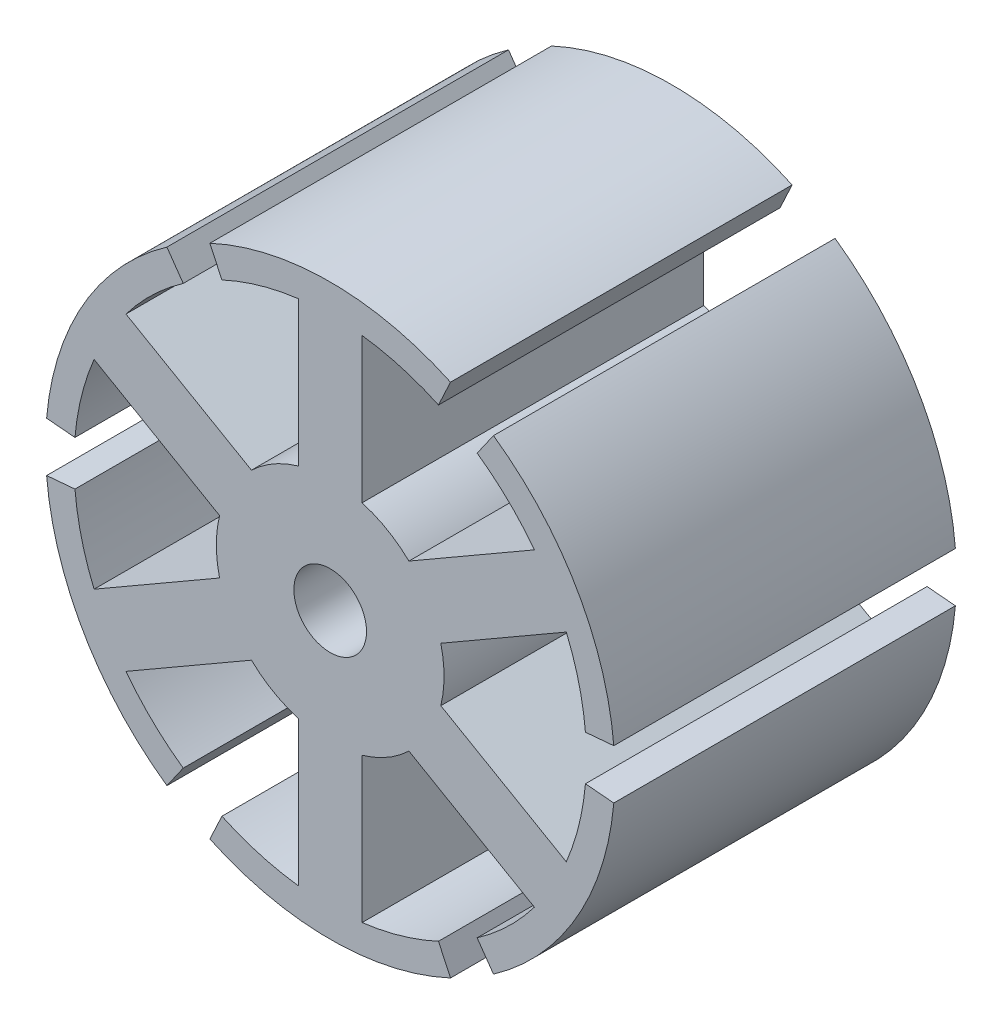
from build123d import *

# Parameters (mm, degrees)
SKETCH2_R           = 25
BOSS_EXTRUDE2_DEPTH = 30
CUT_EXTRUDE2_START  = -30
CUT_EXTRUDE2_DEPTH  = 30
SKETCH4_R           = 3.19
CUT_EXTRUDE3_DEPTH  = 30


with BuildPart() as part:
    # Sketch2 → Boss-Extrude2 (new body)
    with BuildSketch(Plane.XY):
        Circle(SKETCH2_R)
    extrude(amount=BOSS_EXTRUDE2_DEPTH)

    # Sketch3 → Cut-Extrude2 (cut)
    with BuildSketch(Plane.XY.offset(30).offset(CUT_EXTRUDE2_START)):
        with BuildLine():
            Line((6.913843876, -7.224871131), (17.934101996, -13.587420123))
            ThreePointArc((17.934101996, -13.587420123), (15.608801126, -16.205410436), (12.905469818, -18.430920997))
            Line((12.905469818, -18.430920997), (14.339410909, -20.478801107))
            ThreePointArc((14.339410909, -20.478801107), (12.5, -21.650635095), (10.565456544, -22.657694676))
            Line((10.565456544, -22.657694676), (9.508910889, -20.391925208))
            ThreePointArc((9.508910889, -20.391925208), (6.229896553, -21.620323516), (2.8, -22.325097984))
            Line((2.8, -22.325097984), (2.8, -9.6))
            ThreePointArc((2.8, -9.6), (5, -8.660254038), (6.913843876, -7.224871131))
        make_face()
        with BuildLine():
            Line((9.713843876, -2.375128869), (20.734101996, -8.737677861))
            ThreePointArc((20.734101996, -8.737677861), (21.83869768, -5.41491308), (22.414380707, -1.961004212))
            Line((22.414380707, -1.961004212), (24.904867452, -2.178893569))
            ThreePointArc((24.904867452, -2.178893569), (25, 0), (24.904867452, 2.178893569))
            Line((24.904867452, 2.178893569), (22.414380707, 1.961004212))
            ThreePointArc((22.414380707, 1.961004212), (21.83869768, 5.41491308), (20.734101996, 8.737677861))
            Line((20.734101996, 8.737677861), (9.713843876, 2.375128869))
            ThreePointArc((9.713843876, 2.375128869), (10, 0), (9.713843876, -2.375128869))
        make_face()
        with BuildLine():
            Line((-2.8, -9.6), (-2.8, -22.325097984))
            ThreePointArc((-2.8, -22.325097984), (-6.229896553, -21.620323516), (-9.508910889, -20.391925208))
            Line((-9.508910889, -20.391925208), (-10.565456544, -22.657694676))
            ThreePointArc((-10.565456544, -22.657694676), (-12.5, -21.650635095), (-14.339410909, -20.478801107))
            Line((-14.339410909, -20.478801107), (-12.905469818, -18.430920997))
            ThreePointArc((-12.905469818, -18.430920997), (-15.608801126, -16.205410436), (-17.934101996, -13.587420123))
            Line((-17.934101996, -13.587420123), (-6.913843876, -7.224871131))
            ThreePointArc((-6.913843876, -7.224871131), (-5, -8.660254038), (-2.8, -9.6))
        make_face()
        with BuildLine():
            Line((-9.713843876, -2.375128869), (-20.734101996, -8.737677861))
            ThreePointArc((-20.734101996, -8.737677861), (-21.83869768, -5.41491308), (-22.414380707, -1.961004212))
            Line((-22.414380707, -1.961004212), (-24.904867452, -2.178893569))
            ThreePointArc((-24.904867452, -2.178893569), (-25, 0), (-24.904867452, 2.178893569))
            Line((-24.904867452, 2.178893569), (-22.414380707, 1.961004212))
            ThreePointArc((-22.414380707, 1.961004212), (-21.83869768, 5.41491308), (-20.734101996, 8.737677861))
            Line((-20.734101996, 8.737677861), (-9.713843876, 2.375128869))
            ThreePointArc((-9.713843876, 2.375128869), (-10, 0), (-9.713843876, -2.375128869))
        make_face()
        with BuildLine():
            Line((-6.913843876, 7.224871131), (-17.934101996, 13.587420123))
            ThreePointArc((-17.934101996, 13.587420123), (-15.608801126, 16.205410436), (-12.905469818, 18.430920997))
            Line((-12.905469818, 18.430920997), (-14.339410909, 20.478801107))
            ThreePointArc((-14.339410909, 20.478801107), (-12.5, 21.650635095), (-10.565456544, 22.657694676))
            Line((-10.565456544, 22.657694676), (-9.508910889, 20.391925208))
            ThreePointArc((-9.508910889, 20.391925208), (-6.229896553, 21.620323516), (-2.8, 22.325097984))
            Line((-2.8, 22.325097984), (-2.8, 9.6))
            ThreePointArc((-2.8, 9.6), (-5, 8.660254038), (-6.913843876, 7.224871131))
        make_face()
        with BuildLine():
            Line((2.8, 9.6), (2.8, 22.325097984))
            ThreePointArc((2.8, 22.325097984), (6.229896553, 21.620323516), (9.508910889, 20.391925208))
            Line((9.508910889, 20.391925208), (10.565456544, 22.657694676))
            ThreePointArc((10.565456544, 22.657694676), (12.5, 21.650635095), (14.339410909, 20.478801107))
            Line((14.339410909, 20.478801107), (12.905469818, 18.430920997))
            ThreePointArc((12.905469818, 18.430920997), (15.608801126, 16.205410436), (17.934101996, 13.587420123))
            Line((17.934101996, 13.587420123), (6.913843876, 7.224871131))
            ThreePointArc((6.913843876, 7.224871131), (5, 8.660254038), (2.8, 9.6))
        make_face()
    extrude(amount=CUT_EXTRUDE2_DEPTH, mode=Mode.SUBTRACT)

    # Sketch4 → Cut-Extrude3 (cut)
    with BuildSketch(Plane.XY.offset(30)):
        Circle(SKETCH4_R)
    extrude(amount=-CUT_EXTRUDE3_DEPTH, mode=Mode.SUBTRACT)


solid = part.part
